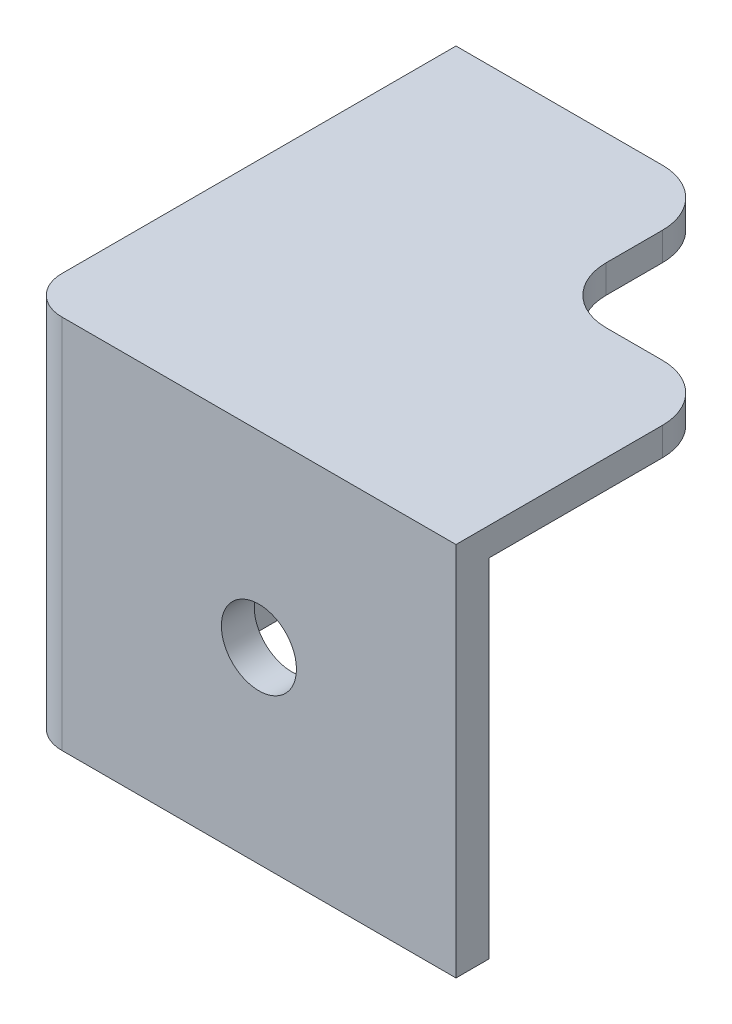
from build123d import *

# Parameters (mm, degrees)
SALIENTE_EXTRUIR1_DEPTH = 20
CORTAR_EXTRUIR1_DEPTH   = 18.5
REDONDEO1_R             = 2
REDONDEO2_R             = 3
CROQUIS3_R              = 2
CORTAR_EXTRUIR2_DEPTH   = 18.5
CROQUIS4_R              = 2
CORTAR_EXTRUIR3_DEPTH   = 18.5


with BuildPart() as part:
    # Croquis1 → Saliente-Extruir1 (new body)
    with BuildSketch(Plane(origin=(0, 0, 0), x_dir=(1, 0, 0), z_dir=(0, 1, 0))):
        Polygon((0, 0), (23, 0), (23, 14), (14, 14), (14, 23), (0, 23), align=None)
    extrude(amount=SALIENTE_EXTRUIR1_DEPTH)

    # Croquis2 → Cortar-Extruir1 (cut)
    with BuildSketch(Plane.XZ):
        Polygon((1.75, -23), (1.75, -1.75), (23, -1.75), (23, -14), (14, -14), (14, -23), align=None)
    extrude(amount=-CORTAR_EXTRUIR1_DEPTH, mode=Mode.SUBTRACT)

    # Redondeo1
    redondeo1_edges = [part.edges().sort_by_distance(p)[0] for p in [
        (0, 10, 0),
        (1.75, 9.25, -1.75),
    ]]
    fillet(redondeo1_edges, radius=REDONDEO1_R)

    # Redondeo2
    redondeo2_edges = [part.edges().sort_by_distance(p)[0] for p in [
        (14, 19.25, -23),
        (14, 19.25, -14),
        (23, 19.25, -14),
    ]]
    fillet(redondeo2_edges, radius=REDONDEO2_R)

    # Croquis3 → Cortar-Extruir2 (cut)
    with BuildSketch(Plane.ZY):
        with Locations((-12.5, 10)):
            Circle(CROQUIS3_R)
    extrude(amount=-CORTAR_EXTRUIR2_DEPTH, mode=Mode.SUBTRACT)

    # Croquis4 → Cortar-Extruir3 (cut)
    with BuildSketch(Plane.XY):
        with Locations((12.5, 10)):
            Circle(CROQUIS4_R)
    extrude(amount=-CORTAR_EXTRUIR3_DEPTH, mode=Mode.SUBTRACT)


solid = part.part
